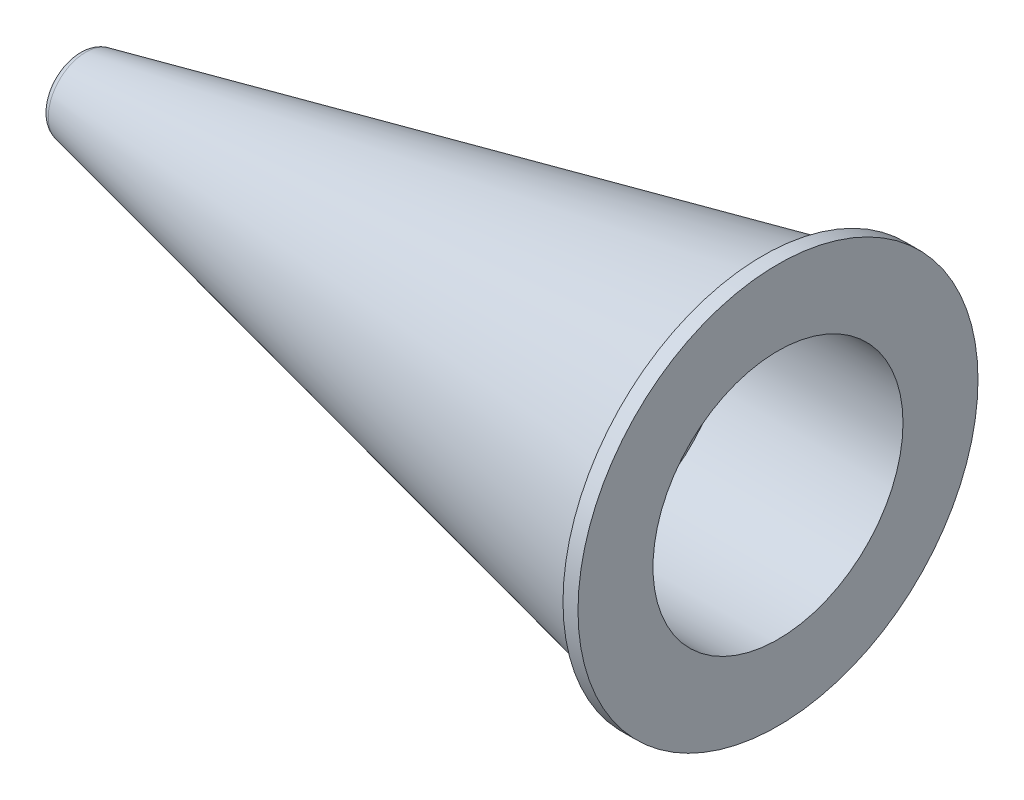
from build123d import *

# Parameters (mm, degrees)
SKETCH_2_R          = 2.5
CUT_EXTRUDE_1_DEPTH = 3.5
SKETCH_3_R          = 1.5
CUT_EXTRUDE_2_DEPTH = 1
FILLET_1_R          = 0.2
SKETCH_4_R          = 0.05
EXTRUDE_1_DEPTH     = 0.05


with BuildPart() as part:
    # 草图1 → 旋转1 (revolve)
    with BuildSketch(Plane.XY, mode=Mode.PRIVATE) as revolve_1_sk:
        Polygon((0, 0), (0, 4), (-0.3, 4), (-0.3, 3.7), (-15, 0.5), (-15, 0), align=None)
    revolve(revolve_1_sk.sketch.rotate(Axis((-15, 0, 0), (1, 0, 0)), 90), axis=Axis((-15, 0, 0), (1, 0, 0)))

    # 草图2 → 切除-拉伸1 (cut)
    with BuildSketch(Plane(origin=(0, 0, 0), x_dir=(0, 0, -1), z_dir=(1, 0, 0))):
        Circle(SKETCH_2_R)
    extrude(amount=-CUT_EXTRUDE_1_DEPTH, mode=Mode.SUBTRACT)

    # 草图3 → 切除-拉伸2 (cut)
    with BuildSketch(Plane.ZY.offset(15)):
        Circle(SKETCH_3_R)
    extrude(amount=-CUT_EXTRUDE_2_DEPTH, mode=Mode.SUBTRACT)

    # 圆角1
    fillet_1_edges = [part.edges().sort_by_distance(p)[0] for p in [
        (-14, 0, -0.717687075),
    ]]
    fillet(fillet_1_edges, radius=FILLET_1_R)

    # 草图4 → 凸台-拉伸1 (add)
    with BuildSketch(Plane.ZY.offset(14)):
        Circle(SKETCH_4_R)
    extrude(amount=EXTRUDE_1_DEPTH)

    # 草图5 → 切除-旋转1 (revolve, cut)
    with BuildSketch(Plane(origin=(0, 0, 0), x_dir=(1, 0, 0), z_dir=(0, 1, 0)), mode=Mode.PRIVATE) as cut_revolve_1_sk:
        Polygon((-14, -0.05), (-14.05, -0.03), (-14.05, -0.05), align=None)
    revolve(cut_revolve_1_sk.sketch.rotate(Axis((-14.05, 0, 0), (1, 0, 0)), 180), axis=Axis((-14.05, 0, 0), (1, 0, 0)), mode=Mode.SUBTRACT)


solid = part.part
